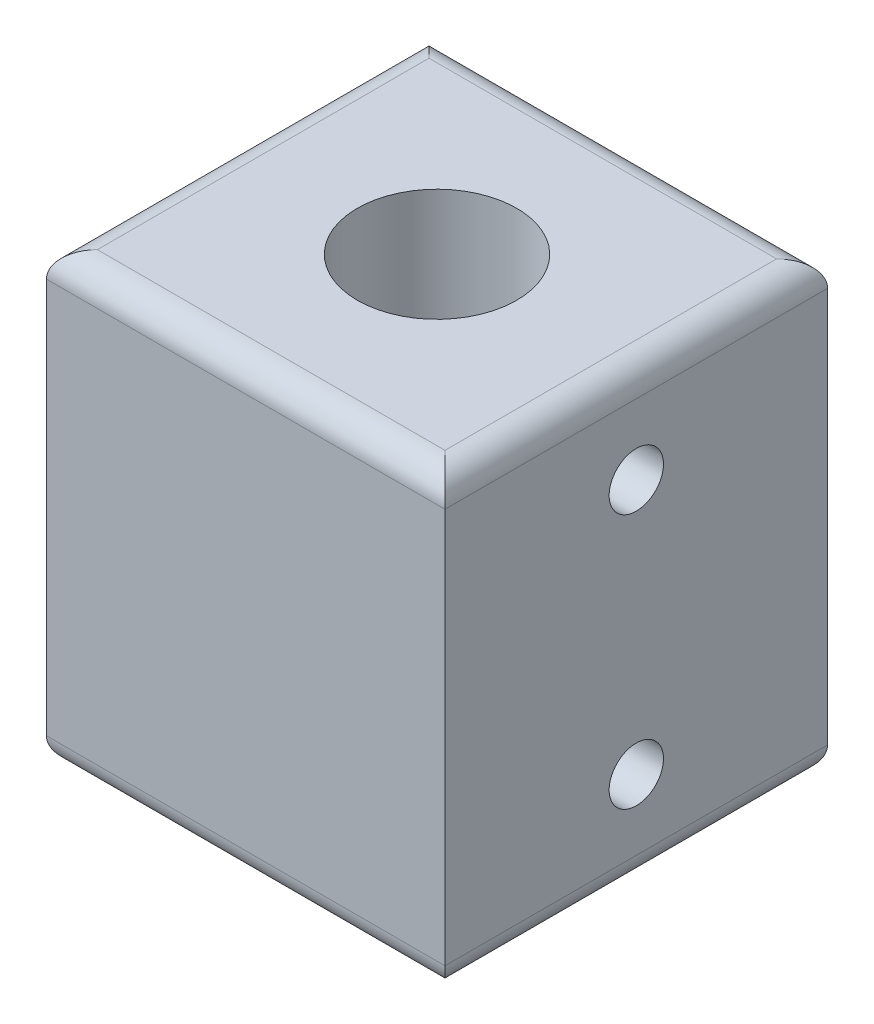
from build123d import *

# Parameters (mm, degrees)
SKETCH1_W                 = 19.84502
SKETCH1_H                 = 22.225
BODY_DEPTH                = 19.05
YAW_AXLE_OPENING_DEPTH    = 36.364925333
F_6_32_TAPPED_HOLE1_D     = 2.7051
F_6_32_TAPPED_HOLE1_DEPTH = 4.7625
F_6_32_TAPPED_HOLE1_TIP   = 0.81269403
F_6_32_TAPPED_HOLE2_D     = 2.7051
F_6_32_TAPPED_HOLE2_DEPTH = 4.7625
F_6_32_TAPPED_HOLE2_TIP   = 0.81269403
F_6_32_TAPPED_HOLE3_D     = 2.7051
F_6_32_TAPPED_HOLE3_DEPTH = 3.81
F_6_32_TAPPED_HOLE3_TIP   = 0.81269403
FILLET1_R                 = 1.27


with BuildPart() as part:
    # Sketch1 → Body (new body)
    with BuildSketch(Plane.XY):
        with Locations((9.92251, 11.1125)):
            Rectangle(SKETCH1_W, SKETCH1_H)
    extrude(amount=BODY_DEPTH)

    # Sketch2 → Yaw Axle Opening (cut, through all)
    with BuildSketch(Plane(origin=(0, 22.225, 0), x_dir=(1, 0, 0), z_dir=(0, 1, 0))):
        with BuildLine():
            ThreePointArc((13.89126, -9.525), (12.728840038, -6.718669962), (9.92251, -5.55625))
            Line((9.92251, -5.55625), (9.92251, -9.525))
            Line((9.92251, -9.525), (13.89126, -9.525))
        make_face()
        with BuildLine():
            Line((9.92251, -9.525), (9.92251, -5.55625))
            ThreePointArc((9.92251, -5.55625), (7.116179962, -6.718669962), (5.95376, -9.525))
            Line((5.95376, -9.525), (9.92251, -9.525))
        make_face()
        with BuildLine():
            Line((13.89126, -9.525), (9.92251, -9.525))
            Line((9.92251, -9.525), (9.92251, -13.49375))
            ThreePointArc((9.92251, -13.49375), (12.728840038, -12.331330038), (13.89126, -9.525))
        make_face()
        with BuildLine():
            Line((9.92251, -13.49375), (9.92251, -9.525))
            Line((9.92251, -9.525), (5.95376, -9.525))
            ThreePointArc((5.95376, -9.525), (7.116179962, -12.331330038), (9.92251, -13.49375))
        make_face()
    extrude(amount=-YAW_AXLE_OPENING_DEPTH, mode=Mode.SUBTRACT)

    # #6-32 Tapped Hole1
    with Locations(Plane(origin=(0, 17.4625, 9.525), x_dir=(0, 0, -1), z_dir=(-1, 0, 0))):
        with Locations((0, 0), (0, 12.7)):
            Hole(F_6_32_TAPPED_HOLE1_D / 2, depth=F_6_32_TAPPED_HOLE1_DEPTH)
            with Locations((0, 0, -(F_6_32_TAPPED_HOLE1_DEPTH + F_6_32_TAPPED_HOLE1_TIP / 2))):  # 118° drill point
                Cone(0, F_6_32_TAPPED_HOLE1_D / 2, F_6_32_TAPPED_HOLE1_TIP, mode=Mode.SUBTRACT)

    # #6-32 Tapped Hole2
    with Locations(Plane(origin=(19.84502, 17.4625, 9.525), x_dir=(0, 1, 0), z_dir=(1, 0, 0))):
        with Locations((0, 0), (-12.7, 0)):
            Hole(F_6_32_TAPPED_HOLE2_D / 2, depth=F_6_32_TAPPED_HOLE2_DEPTH)
            with Locations((0, 0, -(F_6_32_TAPPED_HOLE2_DEPTH + F_6_32_TAPPED_HOLE2_TIP / 2))):  # 118° drill point
                Cone(0, F_6_32_TAPPED_HOLE2_D / 2, F_6_32_TAPPED_HOLE2_TIP, mode=Mode.SUBTRACT)

    # #6-32 Tapped Hole3
    with Locations(Plane(origin=(0, 0, 0), x_dir=(-1, 0, 0), z_dir=(0, 0, -1))):
        with Locations((-9.92251, 17.225)):
            Hole(F_6_32_TAPPED_HOLE3_D / 2, depth=F_6_32_TAPPED_HOLE3_DEPTH)
            with Locations((0, 0, -(F_6_32_TAPPED_HOLE3_DEPTH + F_6_32_TAPPED_HOLE3_TIP / 2))):  # 118° drill point
                Cone(0, F_6_32_TAPPED_HOLE3_D / 2, F_6_32_TAPPED_HOLE3_TIP, mode=Mode.SUBTRACT)

    # Fillet1
    fillet1_edges = [part.edges().sort_by_distance(p)[0] for p in [
        (9.92251, 22.225, 19.05),
        (9.92251, 22.225, 0),
        (9.92251, 0, 0),
        (9.92251, 0, 19.05),
        (0, 22.225, 9.525),
        (19.84502, 22.225, 9.525),
        (19.84502, 0, 9.525),
        (0, 0, 9.525),
    ]]
    fillet(fillet1_edges, radius=FILLET1_R)


solid = part.part
